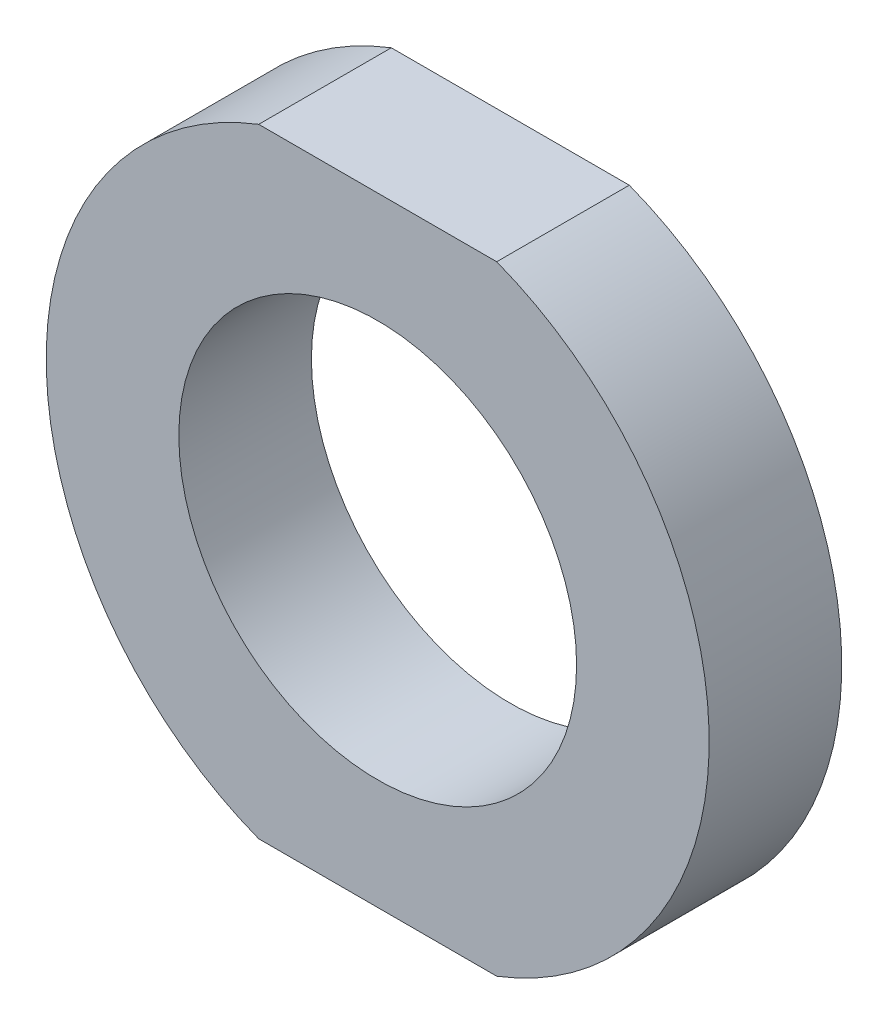
from build123d import *

# Parameters (mm, degrees)
SKETCH_1_R      = 4.5
EXTRUDE_1_DEPTH = 3


with BuildPart() as part:
    # 草图1 → 凸台-拉伸1 (new body)
    with BuildSketch(Plane.XY):
        with BuildLine():
            Line((-2.692582404, 7), (2.692582404, 7))
            ThreePointArc((2.692582404, 7), (7.5, 0), (2.692582404, -7))
            Line((2.692582404, -7), (-2.692582404, -7))
            ThreePointArc((-2.692582404, -7), (-7.5, 0), (-2.692582404, 7))
        make_face()
        Circle(SKETCH_1_R, mode=Mode.SUBTRACT)
    extrude(amount=EXTRUDE_1_DEPTH)


solid = part.part
